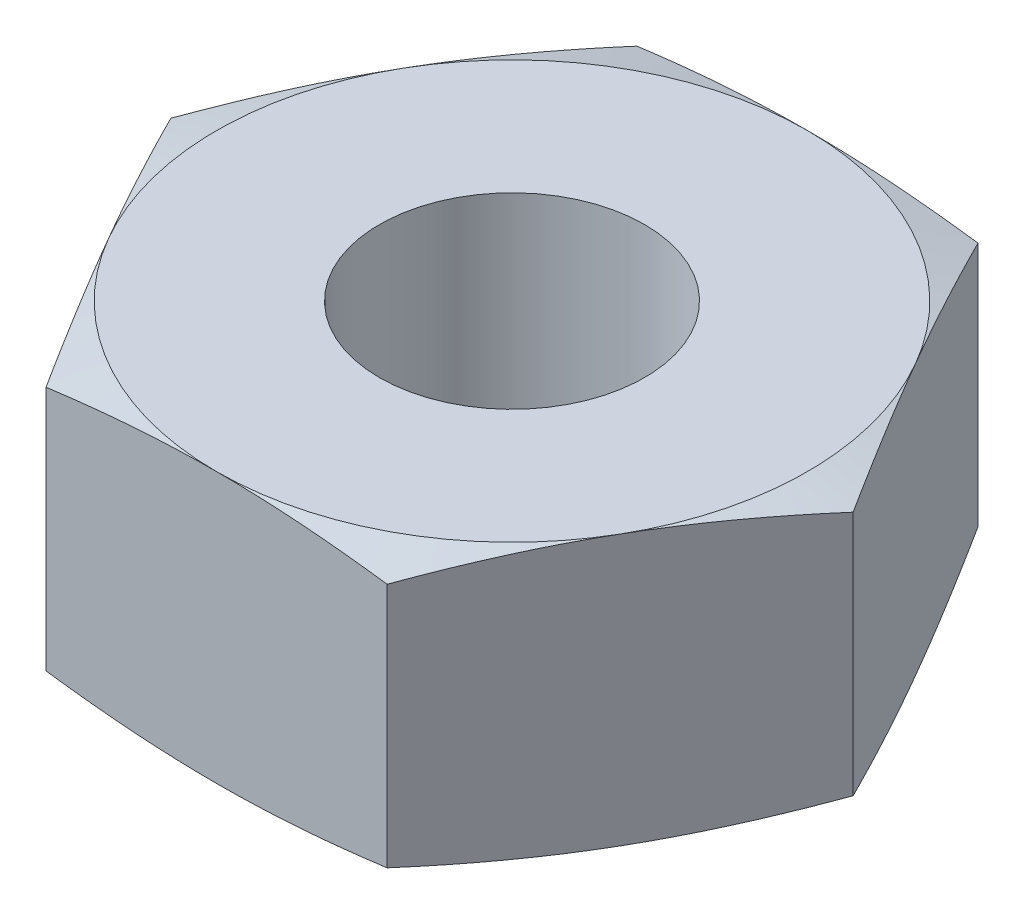
from build123d import *

# Parameters (mm, degrees)
EXTRUDE1_DEPTH = 1.6
SKETCH3_R      = 1.571
EXTRUDE2_DEPTH = 7.23083729


with BuildPart() as part:
    # Sketch1 → Extrude1 (new, symmetric)
    with BuildSketch(Plane(origin=(0, 0, 0), x_dir=(1, 0, 0), z_dir=(0, 1, 0))):
        Polygon((4.041451884, 0), (2.020725942, 3.5), (-2.020725942, 3.5), (-4.041451884, 0), (-2.020725942, -3.5), (2.020725942, -3.5), align=None)
    extrude(amount=EXTRUDE1_DEPTH, both=True)

    # Sketch2 → Cut-Revolve1 (revolve, cut)
    with BuildSketch(Plane(origin=(0, 0, 0), x_dir=(0, 0, -1), z_dir=(1, 0, 0))):
        Polygon((-3.5, 1.6), (-77.930479483, -18.34358687), (-77.930479483, 1.6), align=None)
    cut_revolve1 = revolve(axis=Axis((0, 0, 0), (0, 1, 0)), mode=Mode.SUBTRACT)

    # Mirror1: Cut-Revolve1 across plane
    add(cut_revolve1.mirror(Plane.ZX), mode=Mode.SUBTRACT)

    # Sketch3 → Extrude2 (cut, through all)
    with BuildSketch(Plane(origin=(0, 1.6, 0), x_dir=(1, 0, 0), z_dir=(0, 1, 0))):
        with Locations(Location((0, 0, 0), (0, 0, 270))):
            Circle(SKETCH3_R)
    extrude(amount=-EXTRUDE2_DEPTH, mode=Mode.SUBTRACT)


solid = part.part
